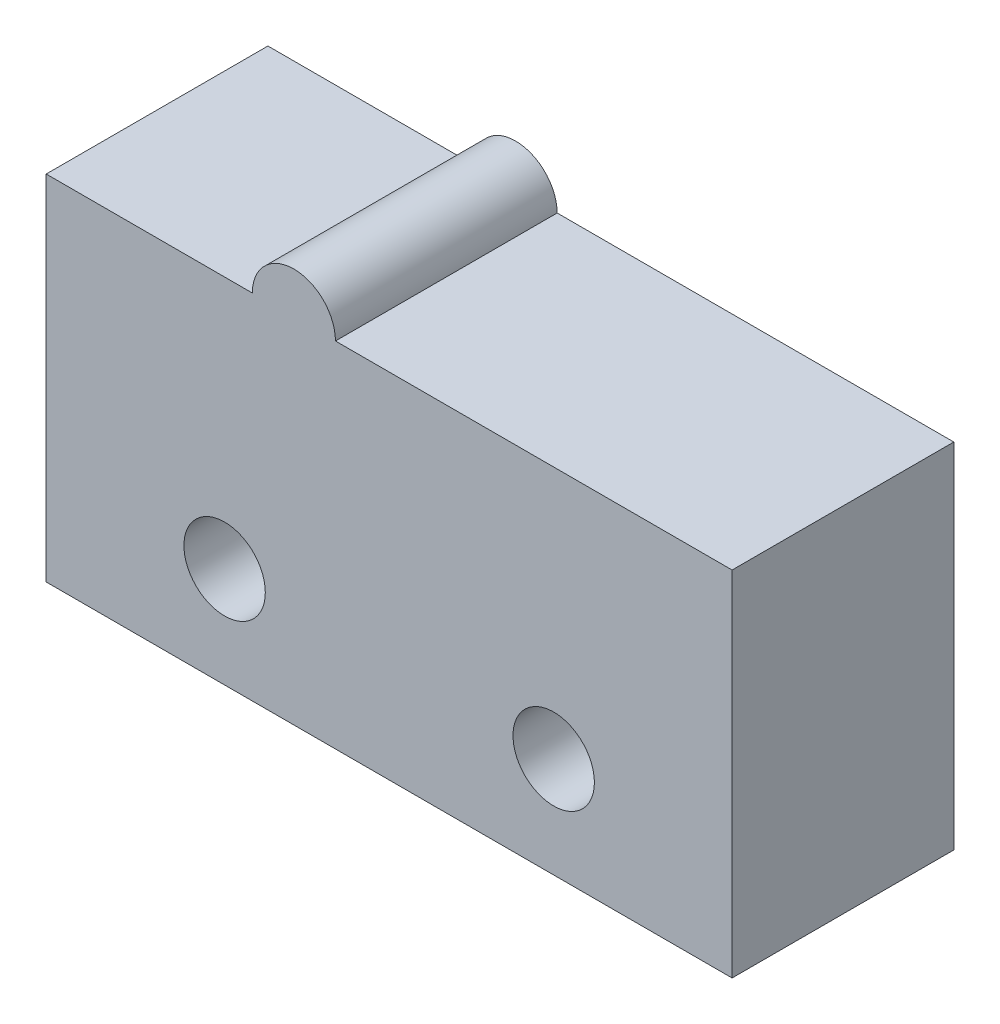
from build123d import *

# Parameters (mm, degrees)
SKETCH1_R           = 1.175
BOSS_EXTRUDE1_DEPTH = 6.4


with BuildPart() as part:
    # Sketch1 → Boss-Extrude1 (new body)
    with BuildSketch(Plane.XY):
        with BuildLine():
            Line((0, 0), (19.8, 0))
            Line((19.8, 0), (19.8, 10.2))
            Line((19.8, 10.2), (8.35, 10.2))
            ThreePointArc((8.35, 10.2), (7.15, 11.4), (5.95, 10.2))
            Line((5.95, 10.2), (0, 10.2))
            Line((0, 10.2), (0, 0))
        make_face()
        with Locations((14.65, 2.9)):
            Circle(SKETCH1_R, mode=Mode.SUBTRACT)
        with Locations((5.15, 2.9)):
            Circle(SKETCH1_R, mode=Mode.SUBTRACT)
    extrude(amount=BOSS_EXTRUDE1_DEPTH)


solid = part.part
